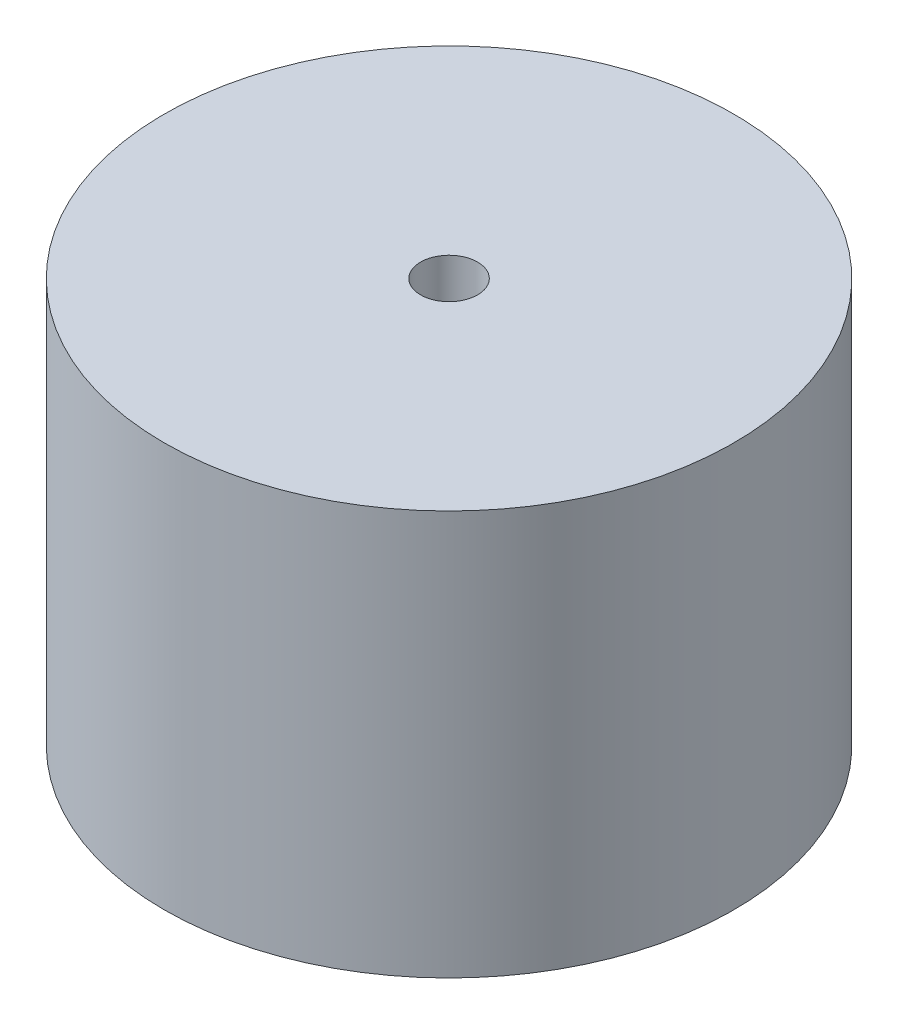
from build123d import *

# Parameters (mm, degrees)
SKETCH1_R           = 12.7
BOSS_EXTRUDE1_DEPTH = 18.034
CUT_EXTRUDE1_REACH  = 27.452
SKETCH2_R           = 1.27


with BuildPart() as part:
    # Sketch1 → Boss-Extrude1 (new body)
    with BuildSketch(Plane(origin=(0, 0, 0), x_dir=(1, 0, 0), z_dir=(0, 1, 0))):
        with Locations(Location((0, 0, 0), (0, 0, 270))):
            Circle(SKETCH1_R)
    extrude(amount=BOSS_EXTRUDE1_DEPTH)

    # Sketch2 → Cut-Extrude1 (cut, up to next)
    with BuildSketch(Plane(origin=(0, 18.034, 0), x_dir=(1, 0, 0), z_dir=(0, 1, 0)), mode=Mode.PRIVATE) as cut_extrude1_sk1:
        with Locations(Location((0, 0, 0), (0, 0, 270))):
            Circle(SKETCH2_R)
    cut_extrude1_tool1 = extrude(cut_extrude1_sk1.sketch, amount=-CUT_EXTRUDE1_REACH, mode=Mode.PRIVATE) & part.part
    add(cut_extrude1_tool1.solids().sort_by_distance((0, 18.034, 0))[0], mode=Mode.SUBTRACT)


solid = part.part
